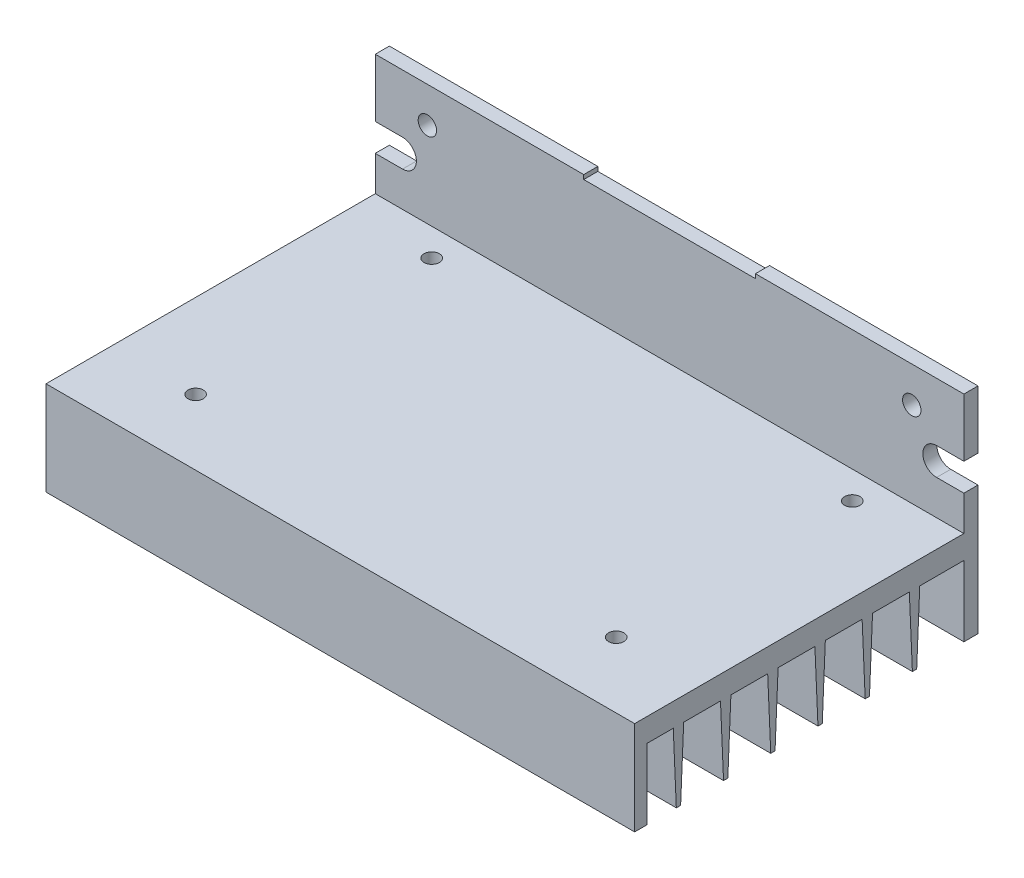
from build123d import *

# Parameters (mm, degrees)
SKETCH1_W                       = 96
SKETCH1_H                       = 56
BOSS_EXTRUDE1_DEPTH             = 3.8
SKETCH2_W                       = 96
SKETCH2_H                       = 35
BOSS_EXTRUDE2_DEPTH             = 2.3
CUT_EXTRUDE1_DEPTH              = 76.762391726
SKETCH4_R                       = 1.5
CUT_EXTRUDE2_DEPTH              = 76.762391726
SKETCH5_W                       = 96
SKETCH5_H                       = 2
BOSS_EXTRUDE3_DEPTH             = 11.5
BOSS_EXTRUDE5_REACH             = 62.334
BOSS_EXTRUDE5_DIRECTION_2_REACH = 62.334
LPATTERN1_COUNT                 = 6
LPATTERN1_PITCH                 = 7.7
SKETCH8_W                       = 28
SKETCH8_H                       = 2.3
CUT_EXTRUDE3_DEPTH              = 0.7
M3X0_5_TAPPED_HOLE1_D           = 2.5
LPATTERN2_COUNT                 = 2
LPATTERN2_PITCH                 = 38.5


with BuildPart() as part:
    # Sketch1 → Boss-Extrude1 (new body)
    with BuildSketch(Plane(origin=(0, 0, 0), x_dir=(1, 0, 0), z_dir=(0, 1, 0))):
        Rectangle(SKETCH1_W, SKETCH1_H)
    extrude(amount=BOSS_EXTRUDE1_DEPTH)

    # Sketch2 → Boss-Extrude2 (add)
    with BuildSketch(Plane(origin=(0, 0, -28), x_dir=(-1, 0, 0), z_dir=(0, 0, -1))):
        with Locations((0, 6)):
            Rectangle(SKETCH2_W, SKETCH2_H)
    extrude(amount=-BOSS_EXTRUDE2_DEPTH)

    # Sketch3 → Cut-Extrude1 (cut, through all)
    with BuildSketch(Plane(origin=(0, 0, -25.7), x_dir=(-1, 0, 0), z_dir=(0, 0, -1))):
        with BuildLine():
            Line((-52.45, 14), (-43.55, 14))
            ThreePointArc((-43.55, 14), (-41.3, 11.75), (-43.55, 9.5))
            Line((-43.55, 9.5), (-52.45, 9.5))
            ThreePointArc((-52.45, 9.5), (-54.7, 11.75), (-52.45, 14))
        make_face()
    cut_extrude1 = extrude(amount=CUT_EXTRUDE1_DEPTH, mode=Mode.SUBTRACT)

    # Sketch4 → Cut-Extrude2 (cut, through all)
    with BuildSketch(Plane.XY.offset(-25.7)):
        with Locations((39.5, 17.7)):
            Circle(SKETCH4_R)
    cut_extrude2 = extrude(amount=-CUT_EXTRUDE2_DEPTH, mode=Mode.SUBTRACT)

    # Mirror1: Cut-Extrude1, Cut-Extrude2 across plane
    add(cut_extrude1.mirror(Plane(origin=(0, 0, 0), x_dir=(0, 0, 1), z_dir=(1, 0, 0))), mode=Mode.SUBTRACT)
    add(cut_extrude2.mirror(Plane(origin=(0, 0, 0), x_dir=(0, 0, 1), z_dir=(1, 0, 0))), mode=Mode.SUBTRACT)

    # Sketch5 → Boss-Extrude3 (add)
    with BuildSketch(Plane(origin=(0, 0, 0), x_dir=(1, 0, 0), z_dir=(0, 1, 0))):
        with Locations((0, -27)):
            Rectangle(SKETCH5_W, SKETCH5_H)
    extrude(amount=-BOSS_EXTRUDE3_DEPTH)

    # Boss-Extrude5: up to this face of the body (flat: up to its plane)
    boss_extrude5_end = Plane(part.part.faces().sort_by_distance((48, 18.75, -26.85))[0])
    # Sketch7 → Boss-Extrude5 (add, up to the picked face)
    with BuildSketch(Plane(origin=(0, 0, 0), x_dir=(0, 0, -1), z_dir=(1, 0, 0)), mode=Mode.PRIVATE) as boss_extrude5_sk1:
        Polygon((-21.7, 0), (-21.2, -11.5), (-20.5, -11.5), (-20, 0), align=None)
    boss_extrude5_tool1 = split(extrude(boss_extrude5_sk1.sketch, amount=BOSS_EXTRUDE5_REACH, mode=Mode.PRIVATE), bisect_by=boss_extrude5_end, keep=Keep.BOTH, mode=Mode.PRIVATE)
    boss_extrude5 = boss_extrude5_tool1.solids().sort_by(Axis((0, -4.951389, 20.85), (1, 0, 0)))[0]
    add(boss_extrude5)

    # Boss-Extrude5 direction 2: up to this face of the body (flat: up to its plane)
    boss_extrude5_direction_2_end = Plane(part.part.faces().sort_by_distance((-48, 18.75, -26.85))[0])
    # Sketch7 → Boss-Extrude5 direction 2 (add, up to the picked face)
    with BuildSketch(Plane(origin=(0, 0, 0), x_dir=(0, 0, -1), z_dir=(1, 0, 0)), mode=Mode.PRIVATE) as boss_extrude5_direction_2_sk1:
        Polygon((-21.7, 0), (-21.2, -11.5), (-20.5, -11.5), (-20, 0), align=None)
    boss_extrude5_direction_2_tool1 = split(extrude(boss_extrude5_direction_2_sk1.sketch, amount=-BOSS_EXTRUDE5_DIRECTION_2_REACH, mode=Mode.PRIVATE), bisect_by=boss_extrude5_direction_2_end, keep=Keep.BOTH, mode=Mode.PRIVATE)
    boss_extrude5_direction_2 = boss_extrude5_direction_2_tool1.solids().sort_by(Axis((0, -4.951389, 20.85), (-1, 0, 0)))[0]
    add(boss_extrude5_direction_2)

    # LPattern1: Boss-Extrude5, Boss-Extrude5 direction 2 ×6
    with Locations(*[(0, 0, -i * LPATTERN1_PITCH) for i in range(1, LPATTERN1_COUNT)]):
        add(boss_extrude5)
        add(boss_extrude5_direction_2)

    # Sketch8 → Cut-Extrude3 (cut)
    with BuildSketch(Plane(origin=(0, 23.5, 0), x_dir=(1, 0, 0), z_dir=(0, 1, 0))):
        with Locations((0, 26.85)):
            Rectangle(SKETCH8_W, SKETCH8_H)
    extrude(amount=-CUT_EXTRUDE3_DEPTH, mode=Mode.SUBTRACT)

    # M3x0.5 Tapped Hole1 (through all)
    with Locations(Plane(origin=(0, 3.8, 0), x_dir=(1, 0, 0), z_dir=(0, 1, 0))):
        with Locations((-34.3, -17.3), (34.3, -17.3)):
            m3x0_5_tapped_hole1 = Hole(M3X0_5_TAPPED_HOLE1_D / 2)

    # LPattern2: M3x0.5 Tapped Hole1 ×2
    with Locations(*[(0, 0, -i * LPATTERN2_PITCH) for i in range(1, LPATTERN2_COUNT)]):
        add(m3x0_5_tapped_hole1, mode=Mode.SUBTRACT)


solid = part.part
